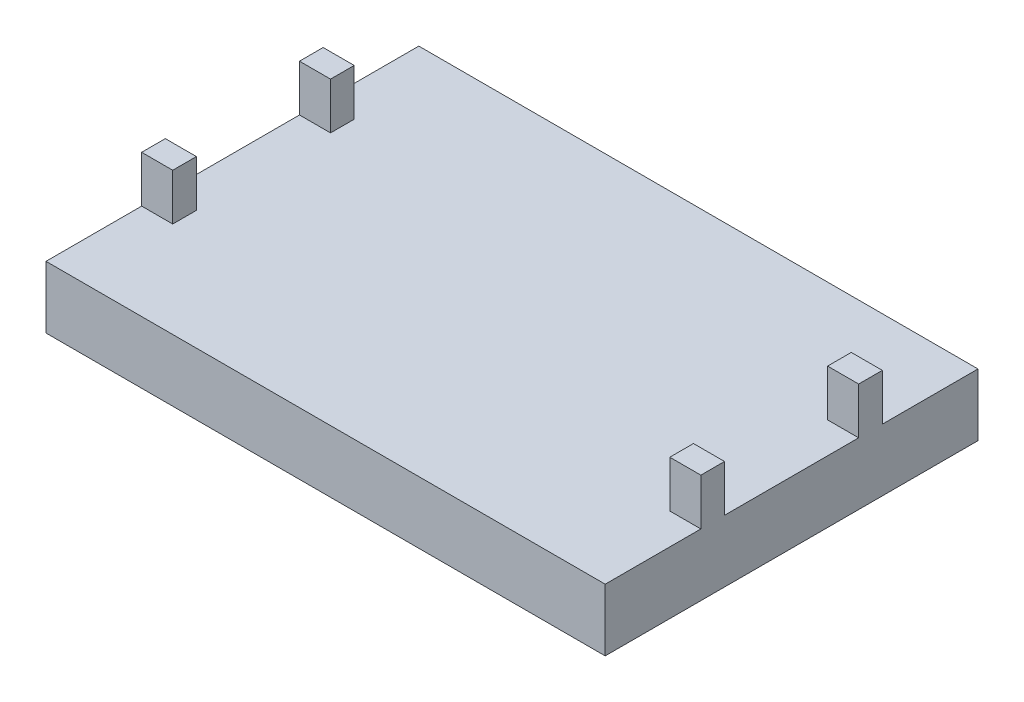
from build123d import *

# Parameters (mm, degrees)
SKETCH1_W           = 90
SKETCH1_H           = 60
BOSS_EXTRUDE1_DEPTH = 10
SKETCH4_W           = 3.81
SKETCH4_H           = 7.5
BOSS_EXTRUDE2_DEPTH = 5


with BuildPart() as part:
    # Sketch1 → Boss-Extrude1 (new body)
    with BuildSketch(Plane(origin=(0, 0, 0), x_dir=(1, 0, 0), z_dir=(0, 1, 0))):
        Rectangle(SKETCH1_W, SKETCH1_H)
    extrude(amount=BOSS_EXTRUDE1_DEPTH)

    # Sketch4 → Boss-Extrude2 (add)
    with BuildSketch(Plane.ZY.offset(45)):
        with Locations((-12.7, 13.75)):
            Rectangle(SKETCH4_W, SKETCH4_H)
        with Locations((12.7, 13.75)):
            Rectangle(SKETCH4_W, SKETCH4_H)
    boss_extrude2 = extrude(amount=-BOSS_EXTRUDE2_DEPTH)

    # Mirror1: Boss-Extrude2 across plane
    add(boss_extrude2.mirror(Plane(origin=(0, 0, 0), x_dir=(0, 0, 1), z_dir=(1, 0, 0))))


solid = part.part
